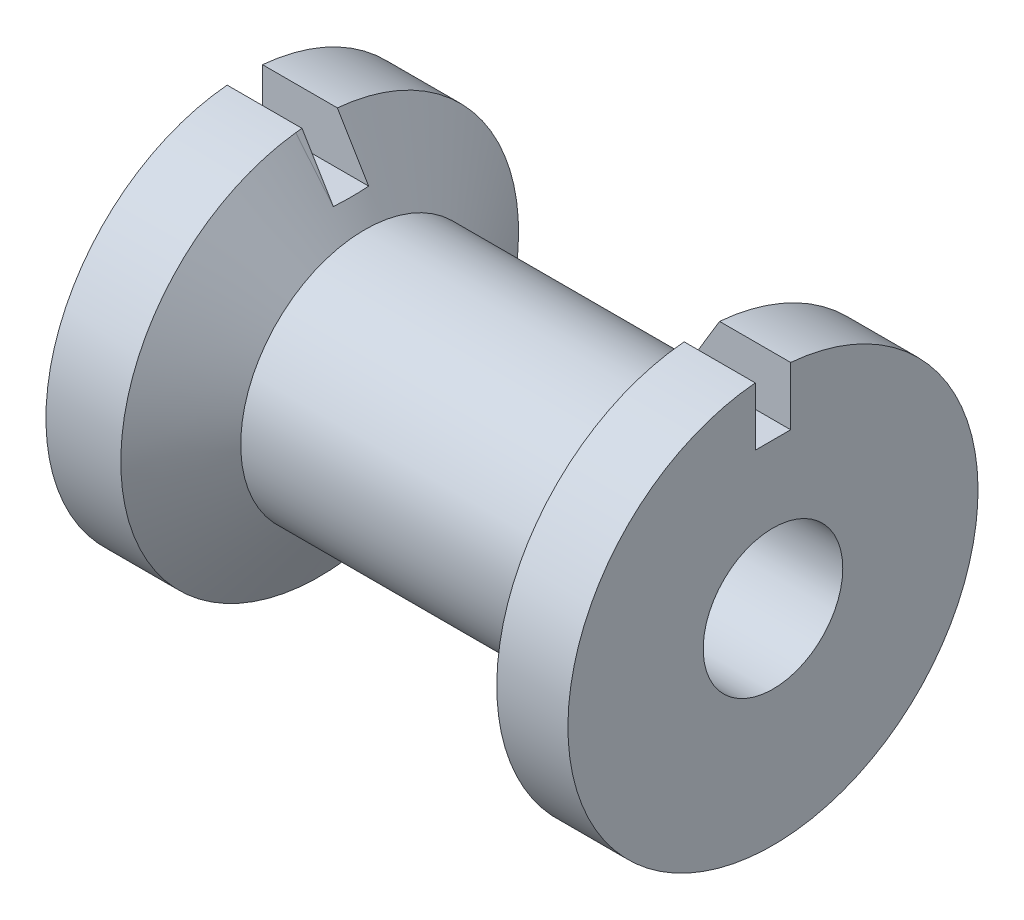
from build123d import *

# Parameters (mm, degrees)
SKETCH2_R          = 6
SKETCH2_W          = 3.042289544
SKETCH2_H          = 10.155281322
CUT_EXTRUDE1_DEPTH = 52.796856473


with BuildPart() as part:
    # Sketch1 → Revolve2 (revolve)
    with BuildSketch(Plane.XY, mode=Mode.PRIVATE) as revolve2_sk:
        Polygon((-12.385789017, 10.66911418), (-16.266149841, 17.097592899), (-22.701695292, 17.097592899), (-22.701695292, 0), (22.701695292, 0), (22.701695292, 17.627343304), (16.585917987, 17.627343304), (12.385789017, 10.66911418), align=None)
    revolve(revolve2_sk.sketch.rotate(Axis((22.701695292, 0, 0), (-1, 0, 0)), 90), axis=Axis((22.701695292, 0, 0), (-1, 0, 0)))

    # Sketch2 → Cut-Extrude1 (cut, through all)
    with BuildSketch(Plane(origin=(22.701695292, 0, 0), x_dir=(0, 0, -1), z_dir=(1, 0, 0))):
        Circle(SKETCH2_R)
        with Locations((0, 17.627343304)):
            Rectangle(SKETCH2_W, SKETCH2_H)
    extrude(amount=-CUT_EXTRUDE1_DEPTH, mode=Mode.SUBTRACT)


solid = part.part
